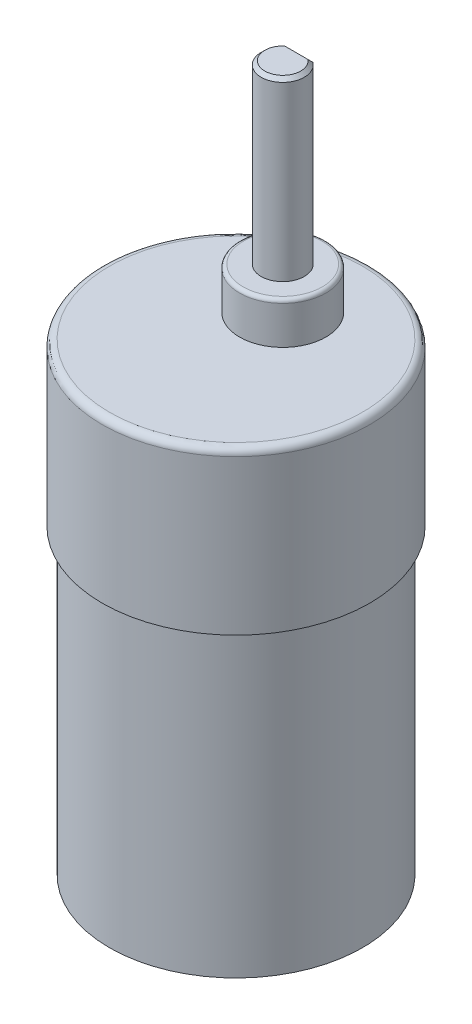
from build123d import *

# Parameters (mm, degrees)
SKETCH1_R           = 18.6
BOSS_EXTRUDE1_DEPTH = 22.5
SKETCH2_R           = 6
BOSS_EXTRUDE2_DEPTH = 5.8
BOSS_EXTRUDE3_DEPTH = 24.5
SKETCH4_R           = 17.6
BOSS_EXTRUDE4_DEPTH = 42
SKETCH5_R           = 17
CUT_EXTRUDE1_DEPTH  = 1
SKETCH6_R           = 4.9
BOSS_EXTRUDE5_DEPTH = 3.7
BOSS_EXTRUDE7_DEPTH = 5
SKETCH9_R           = 0.5
CUT_EXTRUDE3_DEPTH  = 62.010578213
SKETCH10_R          = 0.5
CUT_EXTRUDE4_DEPTH  = 62.324880349
CHAMFER2_SIZE       = 0.5
CHAMFER3_SIZE       = 0.5
FILLET2_R           = 1
FILLET3_R           = 0.5
CHAMFER4_SIZE       = 0.5
FILLET4_R           = 2


with BuildPart() as part:
    # Sketch1 → Boss-Extrude1 (new body)
    with BuildSketch(Plane(origin=(0, 0, 0), x_dir=(1, 0, 0), z_dir=(0, 1, 0))):
        with Locations(Location((0, 0, 0), (0, 0, 90))):
            Circle(SKETCH1_R)
    extrude(amount=BOSS_EXTRUDE1_DEPTH)

    # Sketch2 → Boss-Extrude2 (add)
    with BuildSketch(Plane(origin=(0, 22.5, 0), x_dir=(1, 0, 0), z_dir=(0, 1, 0))):
        with Locations(Location((0, 6.5, 0), (0, 0, 270))):
            Circle(SKETCH2_R)
    extrude(amount=BOSS_EXTRUDE2_DEPTH)

    # Sketch4 → Boss-Extrude4 (add)
    with BuildSketch(Plane.XZ):
        with Locations(Location((0, 0, 0), (0, 0, 90))):
            Circle(SKETCH4_R)
    extrude(amount=BOSS_EXTRUDE4_DEPTH)

    # Sketch5 → Cut-Extrude1 (cut)
    with BuildSketch(Plane.XZ.offset(42)):
        with Locations(Location((0, 0, 0), (0, 0, 270))):
            Circle(SKETCH5_R)
    extrude(amount=-CUT_EXTRUDE1_DEPTH, mode=Mode.SUBTRACT)

    # Sketch6 → Boss-Extrude5 (add)
    with BuildSketch(Plane.XZ.offset(41)):
        with Locations(Location((0, 0, 0), (0, 0, 270))):
            Circle(SKETCH6_R)
    extrude(amount=BOSS_EXTRUDE5_DEPTH)

    # Sketch8 → Boss-Extrude7 (add)
    with BuildSketch(Plane.XZ.offset(41)):
        Polygon((7.943642648, -7.005312351), (8.409423923, -6.823521801), (9.500167221, -9.61820945), (9.034385946, -9.8), align=None)
        Polygon((-8.409423923, -6.823521801), (-7.943642648, -7.005312351), (-9.034385946, -9.8), (-9.500167221, -9.61820945), align=None)
    extrude(amount=BOSS_EXTRUDE7_DEPTH)

    # Sketch9 → Cut-Extrude3 (cut, through all)
    with BuildSketch(Plane(origin=(-5.359437966, 0, -0.384098246), x_dir=(-0.3635810993451648, 0, -0.9315625498048757), z_dir=(0.9315625498048757, 0, -0.36358109934516486))):
        with Locations((8.607643073, -45)):
            Circle(SKETCH9_R)
    extrude(amount=-CUT_EXTRUDE3_DEPTH, mode=Mode.SUBTRACT)

    # Sketch10 → Cut-Extrude4 (cut, through all)
    with BuildSketch(Plane(origin=(4.133997261, 0, 2.755709267), x_dir=(0.36358109934513905, 0, -0.9315625498048857), z_dir=(0.9315625498048857, 0, 0.36358109934513905))):
        with Locations(Location((11.978117245, -45, 0), (0, 0, 180))):
            Circle(SKETCH10_R)
    extrude(amount=CUT_EXTRUDE4_DEPTH, mode=Mode.SUBTRACT)

    # Chamfer2
    chamfer2_edges = [part.edges().sort_by_distance(p)[0] for p in [
        (9.267276584, -46, -9.709104725),
        (8.176533286, -46, -6.914417076),
    ]]
    chamfer(chamfer2_edges, length=CHAMFER2_SIZE)

    # Chamfer3
    chamfer3_edges = [part.edges().sort_by_distance(p)[0] for p in [
        (-8.176533286, -46, -6.914417076),
        (-9.267276584, -46, -9.709104725),
    ]]
    chamfer(chamfer3_edges, length=CHAMFER3_SIZE)

    # Fillet2
    fillet2_edges = [part.edges().sort_by_distance(p)[0] for p in [
        (0, 22.5, 18.6),
    ]]
    fillet(fillet2_edges, radius=FILLET2_R)

    # Fillet3
    fillet3_edges = [part.edges().sort_by_distance(p)[0] for p in [
        (0, 28.3, -12.5),
    ]]
    fillet(fillet3_edges, radius=FILLET3_R)

    # Fillet4
    fillet4_edges = [part.edges().sort_by_distance(p)[0] for p in [
        (0, -44.7, 4.9),
    ]]
    fillet(fillet4_edges, radius=FILLET4_R)


with BuildPart() as body_2:
    # Sketch3 → Boss-Extrude3 (new body)
    with BuildSketch(Plane(origin=(0, 28.3, 0), x_dir=(1, 0, 0), z_dir=(0, 1, 0))):
        with BuildLine():
            Line((-1.8, 8.9), (1.8, 8.9))
            ThreePointArc((1.8, 8.9), (0, 3.5), (-1.8, 8.9))
        make_face()
    extrude(amount=BOSS_EXTRUDE3_DEPTH)

    # Chamfer4
    chamfer4_edges = [body_2.edges().sort_by_distance(p)[0] for p in [
        (0, 52.8, -3.5),
        (0, 52.8, -8.9),
    ]]
    chamfer(chamfer4_edges, length=CHAMFER4_SIZE)


solid = Compound([part.part, body_2.part])
